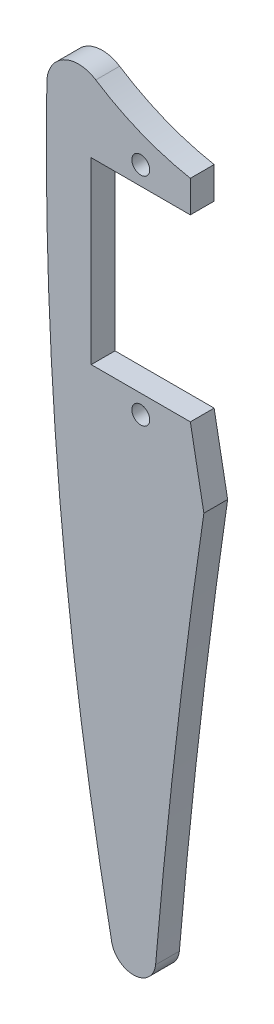
from build123d import *

# Parameters (mm, degrees)
SALIENTE_EXTRUIR1_DEPTH = 3
CROQUIS2_R              = 1.125
CORTAR_EXTRUIR1_DEPTH   = 3


with BuildPart() as part:
    # Croquis1 → Saliente-Extruir1 (new body)
    with BuildSketch(Plane.XY):
        with BuildLine():
            Line((-6.25, 11.3), (6.25, 11.3))
            Line((6.25, 11.3), (6.25, 15.3))
            ThreePointArc((6.25, 15.3), (0.056504012, 17.109442987), (-5.670411261, 20.081970181))
            ThreePointArc((-5.670411261, 20.081970181), (-9.727780496, 20.258869159), (-11.848630151, 16.795412057))
            ThreePointArc((-11.848630151, 16.795412057), (-10.192303885, -28.221209783), (-3.713791608, -72.8))
            ThreePointArc((-3.713791608, -72.8), (-0.923786204, -75.3), (1.8662192, -72.8))
            ThreePointArc((1.8662192, -72.8), (4.506721754, -46.566008889), (7.954822861, -20.425902882))
            Line((7.954822861, -20.425902882), (6.25, -11.3))
            Line((6.25, -11.3), (-6.25, -11.3))
            Line((-6.25, -11.3), (-6.25, 11.3))
        make_face()
    extrude(amount=SALIENTE_EXTRUIR1_DEPTH)

    # Croquis2 → Cortar-Extruir1 (cut)
    with BuildSketch(Plane.XY.offset(3)):
        with Locations((0, 13.65)):
            Circle(CROQUIS2_R)
        with Locations((0, -13.65)):
            Circle(CROQUIS2_R)
    extrude(amount=-CORTAR_EXTRUIR1_DEPTH, mode=Mode.SUBTRACT)


solid = part.part
